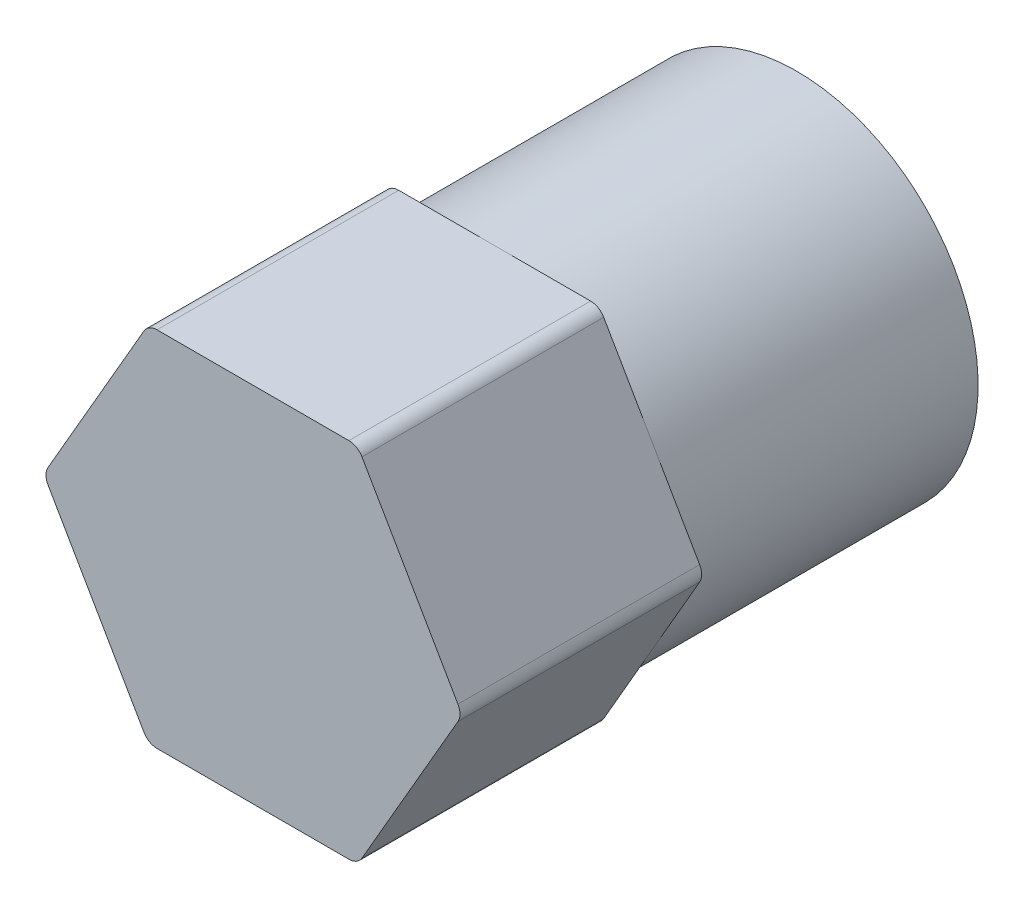
from build123d import *

# Parameters (mm, degrees)
BOSS_EXTRUDE1_DEPTH = 8
SKETCH2_R           = 6
BOSS_EXTRUDE2_DEPTH = 10
CUT_EXTRUDE1_DEPTH  = 8
FILLET1_R           = 0.5


with BuildPart() as part:
    # Sketch1 → Boss-Extrude1 (new body)
    with BuildSketch(Plane.XY):
        Polygon((-3.464101615, -6), (3.464101615, -6), (6.92820323, 0), (3.464101615, 6), (-3.464101615, 6), (-6.92820323, 0), align=None)
    extrude(amount=BOSS_EXTRUDE1_DEPTH)

    # Sketch2 → Boss-Extrude2 (add)
    with BuildSketch(Plane(origin=(0, 0, 0), x_dir=(-1, 0, 0), z_dir=(0, 0, -1))):
        with Locations(Location((0, 0, 0), (0, 0, 150))):
            Circle(SKETCH2_R)
    extrude(amount=BOSS_EXTRUDE2_DEPTH)

    # Sketch3 → Cut-Extrude1 (cut)
    with BuildSketch(Plane(origin=(0, 0, -10), x_dir=(-1, 0, 0), z_dir=(0, 0, -1))):
        with BuildLine():
            Line((-1.35, 1.475635456), (1.35, 1.475635456))
            ThreePointArc((1.35, 1.475635456), (0, -2), (-1.35, 1.475635456))
        make_face()
    extrude(amount=-CUT_EXTRUDE1_DEPTH, mode=Mode.SUBTRACT)

    # Fillet1
    fillet1_edges = [part.edges().sort_by_distance(p)[0] for p in [
        (3.464101615, -6, 4),
        (-3.464101615, -6, 4),
        (-6.92820323, 0, 4),
        (-3.464101615, 6, 4),
        (3.464101615, 6, 4),
        (6.92820323, 0, 4),
    ]]
    fillet(fillet1_edges, radius=FILLET1_R)


solid = part.part
